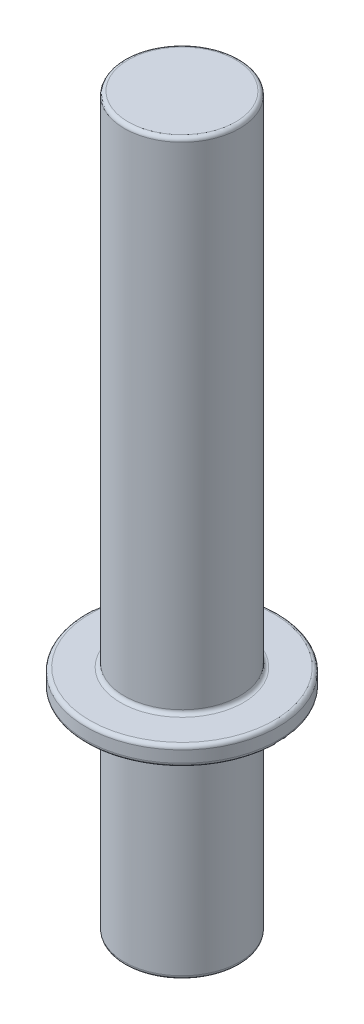
from build123d import *

# Parameters (mm, degrees)
SKETCH_1_R      = 1.5
EXTRUDE_1_DEPTH = 19
EXTRUDE_START   = -5.5
SKETCH_3_R      = 2.5
SKETCH_3_R_2    = 1.5
EXTRUDE_3_DEPTH = 0.5
FILLET_1_R      = 0.1


with BuildPart() as part:
    # 草图1 → 凸台-拉伸1 (new body)
    with BuildSketch(Plane(origin=(0, 0, 0), x_dir=(1, 0, 0), z_dir=(0, 1, 0))):
        with Locations(Location((0, 0, 0), (0, 0, 270))):
            Circle(SKETCH_1_R)
    extrude(amount=EXTRUDE_1_DEPTH)

    # 草图3 → 凸台-拉伸3 (add)
    with BuildSketch(Plane(origin=(0, 0, 0), x_dir=(-1, 0, 0), z_dir=(0, -1, 0)).offset(EXTRUDE_START)):
        with Locations(Location((0, 0, 0), (0, 0, 90))):
            Circle(SKETCH_3_R)
        with Locations(Location((0, 0, 0), (0, 0, 90))):
            Circle(SKETCH_3_R_2, mode=Mode.SUBTRACT)
    extrude(amount=-EXTRUDE_3_DEPTH)

    # 圆角1
    fillet_1_edges = [part.edges().sort_by_distance(p)[0] for p in [
        (0, 0, -1.5),
        (0, 19, -1.5),
        (0, 6, -1.5),
        (0, 5.5, 2.5),
        (0, 6, 2.5),
    ]]
    fillet(fillet_1_edges, radius=FILLET_1_R)


solid = part.part
